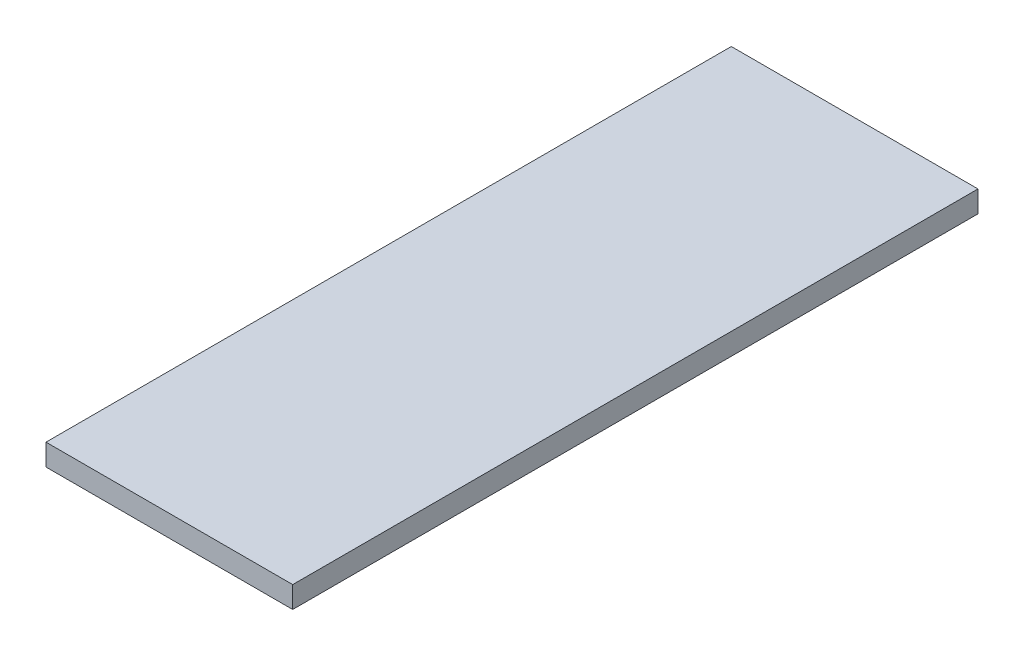
from build123d import *

# Parameters (mm, degrees)
SKETCH1_W           = 57.15
SKETCH1_H           = 158.75
BOSS_EXTRUDE1_DEPTH = 5


with BuildPart() as part:
    # Sketch1 → Boss-Extrude1 (new body)
    with BuildSketch(Plane(origin=(0, 0, 0), x_dir=(1, 0, 0), z_dir=(0, 1, 0))):
        Rectangle(SKETCH1_W, SKETCH1_H)
    extrude(amount=BOSS_EXTRUDE1_DEPTH)


solid = part.part
